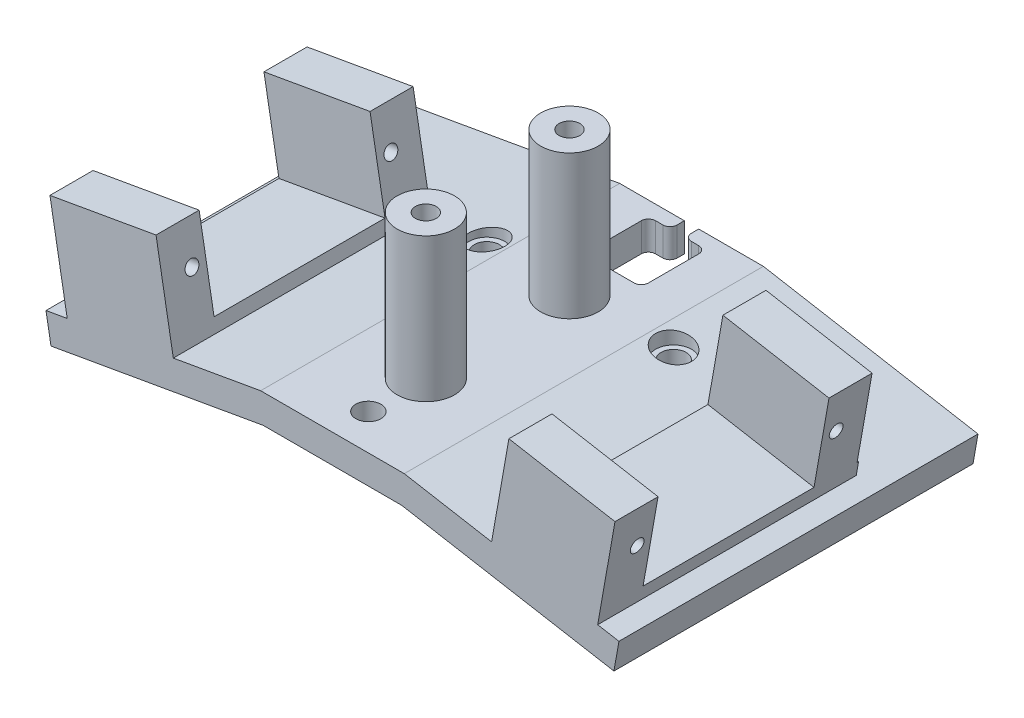
from build123d import *

# Parameters (mm, degrees)
EXTRUDE_1_DEPTH     = 25
EXTRUDE_2_DEPTH     = 36
SKETCH_3_W          = 15
SKETCH_3_H          = 6
EXTRUDE_3_DEPTH     = 12
SKETCH_4_R          = 0.95
CUT_EXTRUDE_1_DEPTH = 21
SKETCH_5_R          = 4
SKETCH_5_R_2        = 1.45
EXTRUDE_4_DEPTH     = 20
EXTRUDE_4_2_DEPTH   = 20
SKETCH_6_R          = 1.75
CUT_EXTRUDE_2_DEPTH = 20
SKETCH_7_R          = 2.5
CUT_EXTRUDE_3_DEPTH = 2
CUT_EXTRUDE_4_DEPTH = 52.148040055
FILLET_4_R          = 1


with BuildPart() as part:
    # 草图1 → 凸台-拉伸1 (new, symmetric)
    with BuildSketch(Plane.XY):
        Polygon((0, 0), (9.650045346, 0), (39.194277936, -5.20944533), (39.888870647, -1.270214318), (10, 4), (0, 4), align=None)
    extrude_1 = extrude(amount=EXTRUDE_1_DEPTH, both=True)

    # 草图2 → 凸台-拉伸2 (add)
    with BuildSketch(Plane.XY.offset(25)):
        Polygon((22.162331093, 1.85545288), (22.483580221, 3.677347223), (37.255696517, 1.072624558), (36.934447388, -0.749269785), align=None)
    extrude_2 = extrude(amount=-EXTRUDE_2_DEPTH)

    # 草图3 → 凸台-拉伸3 (add)
    with BuildSketch(Plane(origin=(1.306826311, 7.411380301, 0), x_dir=(0.9848077530122079, -0.1736481776669312, 0), z_dir=(0.1736481776669312, 0.9848077530122079, 0))):
        with Locations((29.003439474, -22)):
            Rectangle(SKETCH_3_W, SKETCH_3_H)
        with Locations((29.003439474, 7.8)):
            Rectangle(SKETCH_3_W, SKETCH_3_H)
    extrude_3 = extrude(amount=EXTRUDE_3_DEPTH)

    # 草图4 → 切除-拉伸1 (cut)
    with BuildSketch(Plane(origin=(35.948870205, -6.338755743, 0), x_dir=(0, 0, -1), z_dir=(0.9848077530122081, -0.17364817766693072, 0))):
        with Locations(Location((-20.95, 14.025712789, 0), (0, 0, 90))):
            Circle(SKETCH_4_R)
        with Locations(Location((6.75, 14.025712789, 0), (0, 0, 90))):
            Circle(SKETCH_4_R)
    cut_extrude_1 = extrude(amount=-CUT_EXTRUDE_1_DEPTH, mode=Mode.SUBTRACT)

    # 镜向1: 凸台-拉伸1, 凸台-拉伸2, 凸台-拉伸3, 切除-拉伸1 across plane
    add(extrude_1.mirror(Plane(origin=(0, 0, 0), x_dir=(0, 0, 1), z_dir=(1, 0, 0))))
    add(extrude_2.mirror(Plane(origin=(0, 0, 0), x_dir=(0, 0, 1), z_dir=(1, 0, 0))))
    add(extrude_3.mirror(Plane(origin=(0, 0, 0), x_dir=(0, 0, 1), z_dir=(1, 0, 0))))
    add(cut_extrude_1.mirror(Plane(origin=(0, 0, 0), x_dir=(0, 0, 1), z_dir=(1, 0, 0))), mode=Mode.SUBTRACT)

    # 草图6 → 切除-拉伸2 (cut)
    with BuildSketch(Plane(origin=(0, 4, 0), x_dir=(1, 0, 0), z_dir=(0, 1, 0))):
        with Locations(Location((0, -20, 0), (0, 0, 180))):
            Circle(SKETCH_6_R)
        with Locations((-13, 9.5)):
            Circle(SKETCH_6_R)
        with Locations(Location((13, 9.5, 0), (0, 0, 180))):
            Circle(SKETCH_6_R)
    extrude(amount=-CUT_EXTRUDE_2_DEPTH, mode=Mode.SUBTRACT)

    # 草图7 → 切除-拉伸3 (cut)
    with BuildSketch(Plane(origin=(0, 4, 0), x_dir=(1, 0, 0), z_dir=(0, 1, 0))):
        with Locations(Location((-13, 9.5, 0), (0, 0, 180))):
            Circle(SKETCH_7_R)
        with Locations(Location((13, 9.5, 0), (0, 0, 180))):
            Circle(SKETCH_7_R)
    extrude(amount=-CUT_EXTRUDE_3_DEPTH, mode=Mode.SUBTRACT)

    # 草图8 → 切除-拉伸4 (cut, through all)
    with BuildSketch(Plane(origin=(0, 4, 0), x_dir=(1, 0, 0), z_dir=(0, 1, 0))):
        Polygon((-4, 23), (-1, 23), (-1, 25), (1, 25), (1, 23), (4, 23), (4, 14), (-4, 14), align=None)
    extrude(amount=-CUT_EXTRUDE_4_DEPTH, mode=Mode.SUBTRACT)

    # 圆角4
    fillet_4_edges = [part.edges().sort_by_distance(p)[0] for p in [
        (4, 2, -23),
        (4, 2, -14),
        (-4, 2, -14),
        (-4, 2, -23),
        (1, 2, -23),
        (-1, 2, -23),
    ]]
    fillet(fillet_4_edges, radius=FILLET_4_R)


with BuildPart() as body_2:
    # 草图5 → 凸台-拉伸4 (new body)
    with BuildSketch(Plane(origin=(0, 4, 0), x_dir=(1, 0, 0), z_dir=(0, 1, 0))):
        with Locations(Location((0, -12, 0), (0, 0, 180))):
            Circle(SKETCH_5_R)
        with Locations(Location((0, -12, 0), (0, 0, 180))):
            Circle(SKETCH_5_R_2, mode=Mode.SUBTRACT)
    extrude(amount=EXTRUDE_4_DEPTH)


with BuildPart() as body_3:
    # 草图5 → Extrude 4 2 (new body)
    with BuildSketch(Plane(origin=(0, 4, 0), x_dir=(1, 0, 0), z_dir=(0, 1, 0))):
        with Locations(Location((0, 8, 0), (0, 0, 180))):
            Circle(SKETCH_5_R)
        with Locations(Location((0, 8, 0), (0, 0, 180))):
            Circle(SKETCH_5_R_2, mode=Mode.SUBTRACT)
    extrude(amount=EXTRUDE_4_2_DEPTH)


solid = Compound([part.part, body_2.part, body_3.part])
